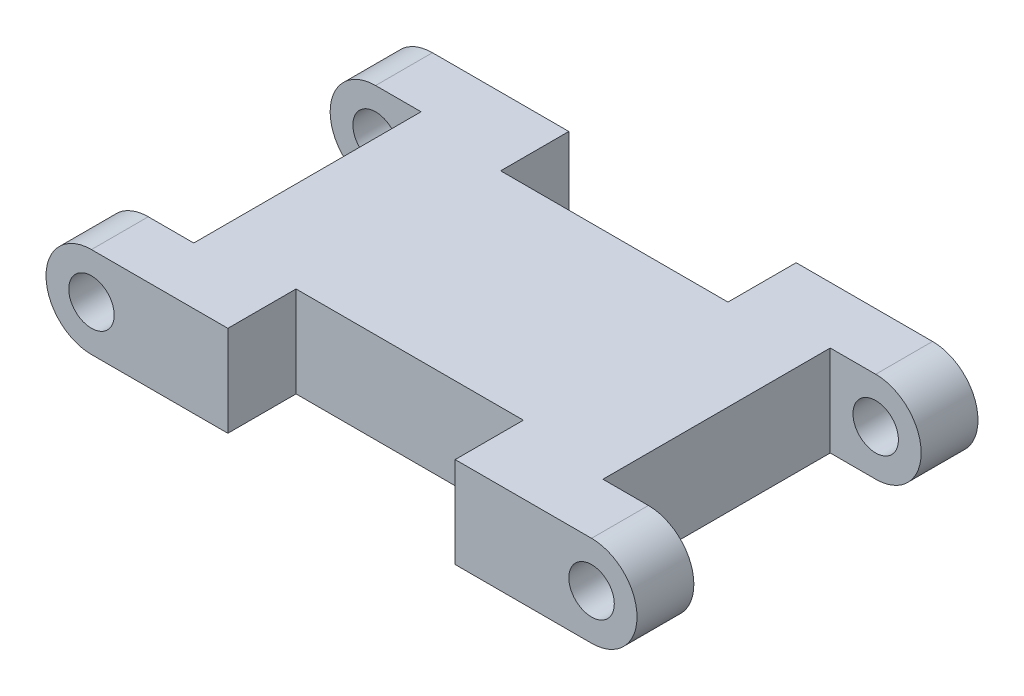
from build123d import *

# Parameters (mm, degrees)
SKETCH1_R           = 1
BOSS_EXTRUDE1_DEPTH = 7.5
CUT_EXTRUDE1_REACH  = 17.532
SKETCH2_W           = 4
SKETCH2_H           = 10
SKETCH2_W_2         = 10
SKETCH2_H_2         = 3


with BuildPart() as part:
    # Sketch1 → Boss-Extrude1 (new, symmetric)
    with BuildSketch(Plane.XY):
        with BuildLine():
            Line((-11, 4), (11, 4))
            ThreePointArc((11, 4), (13, 2), (11, 0))
            Line((11, 0), (-11, 0))
            ThreePointArc((-11, 0), (-13, 2), (-11, 4))
        make_face()
        with Locations((-11, 2)):
            Circle(SKETCH1_R, mode=Mode.SUBTRACT)
        with Locations((11, 2)):
            Circle(SKETCH1_R, mode=Mode.SUBTRACT)
    extrude(amount=BOSS_EXTRUDE1_DEPTH, both=True)

    # Sketch2 → Cut-Extrude1 (cut, up to next)
    with BuildSketch(Plane(origin=(0, 4, 0), x_dir=(1, 0, 0), z_dir=(0, 1, 0)), mode=Mode.PRIVATE) as cut_extrude1_sk1:
        with Locations((-11, 0)):
            Rectangle(SKETCH2_W, SKETCH2_H)
    cut_extrude1_tool1 = extrude(cut_extrude1_sk1.sketch, amount=-CUT_EXTRUDE1_REACH, mode=Mode.PRIVATE) & part.part
    # Sketch2 → Cut-Extrude1 (cut, up to next)
    with BuildSketch(Plane(origin=(0, 4, 0), x_dir=(1, 0, 0), z_dir=(0, 1, 0)), mode=Mode.PRIVATE) as cut_extrude1_sk2:
        with Locations((0, 6)):
            Rectangle(SKETCH2_W_2, SKETCH2_H_2)
    cut_extrude1_tool2 = extrude(cut_extrude1_sk2.sketch, amount=-CUT_EXTRUDE1_REACH, mode=Mode.PRIVATE) & part.part
    # Sketch2 → Cut-Extrude1 (cut, up to next)
    with BuildSketch(Plane(origin=(0, 4, 0), x_dir=(1, 0, 0), z_dir=(0, 1, 0)), mode=Mode.PRIVATE) as cut_extrude1_sk3:
        with Locations((0, -6)):
            Rectangle(SKETCH2_W_2, SKETCH2_H_2)
    cut_extrude1_tool3 = extrude(cut_extrude1_sk3.sketch, amount=-CUT_EXTRUDE1_REACH, mode=Mode.PRIVATE) & part.part
    # Sketch2 → Cut-Extrude1 (cut, up to next)
    with BuildSketch(Plane(origin=(0, 4, 0), x_dir=(1, 0, 0), z_dir=(0, 1, 0)), mode=Mode.PRIVATE) as cut_extrude1_sk4:
        with Locations((11, 0)):
            Rectangle(SKETCH2_W, SKETCH2_H)
    cut_extrude1_tool4 = extrude(cut_extrude1_sk4.sketch, amount=-CUT_EXTRUDE1_REACH, mode=Mode.PRIVATE) & part.part
    add(cut_extrude1_tool1.solids().sort_by_distance((-11, 4, 0))[0], mode=Mode.SUBTRACT)
    add(cut_extrude1_tool2.solids().sort_by_distance((0, 4, -6))[0], mode=Mode.SUBTRACT)
    add(cut_extrude1_tool3.solids().sort_by_distance((0, 4, 6))[0], mode=Mode.SUBTRACT)
    add(cut_extrude1_tool4.solids().sort_by_distance((11, 4, 0))[0], mode=Mode.SUBTRACT)


solid = part.part
